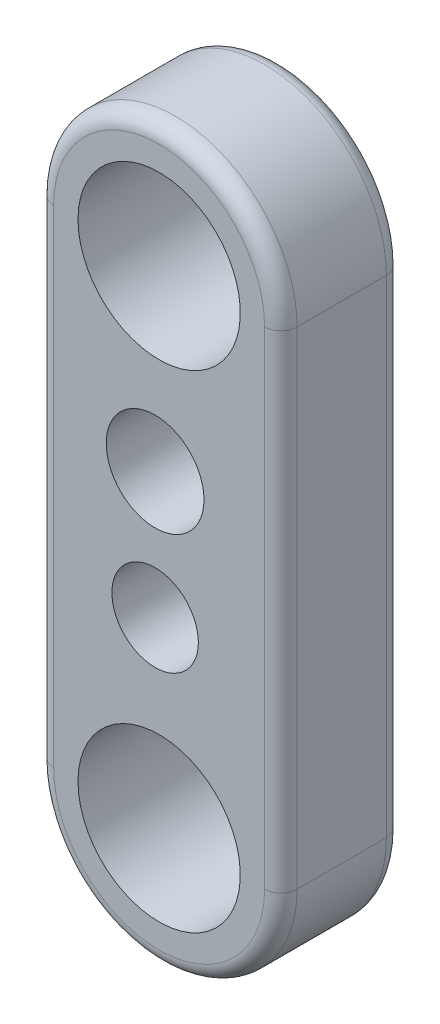
from build123d import *

# Parameters (mm, degrees)
BOSS_EXTRUDE2_DEPTH = 19.05
SKETCH2_R           = 12.7
CUT_EXTRUDE1_DEPTH  = 76.815021516
FILLET1_R           = 2.54
FILLET2_R           = 2.54
SKETCH9_R           = 7.651092206
SKETCH9_R_2         = 6.766631781
CUT_EXTRUDE7_DEPTH  = 76.815021516


with BuildPart() as part:
    # Sketch1 → Boss-Extrude2 (new body)
    with BuildSketch(Plane.XY):
        with BuildLine():
            Line((-29.739928058, 28.163848921), (-29.739928058, -48.036151079))
            ThreePointArc((-29.739928058, -48.036151079), (-10.689928058, -67.086151079), (8.360071942, -48.036151079))
            Line((8.360071942, -48.036151079), (8.360071942, 28.163848921))
            ThreePointArc((8.360071942, 28.163848921), (-10.689928058, 47.213848921), (-29.739928058, 28.163848921))
        make_face()
    extrude(amount=BOSS_EXTRUDE2_DEPTH)

    # Sketch2 → Cut-Extrude1 (cut, through all)
    with BuildSketch(Plane(origin=(0, 0, 0), x_dir=(-1, 0, 0), z_dir=(0, 0, -1))):
        with Locations((10.689928058, 28.163848921)):
            Circle(SKETCH2_R)
        with Locations((10.689928058, -48.036151079)):
            Circle(SKETCH2_R)
    extrude(amount=-CUT_EXTRUDE1_DEPTH, mode=Mode.SUBTRACT)

    # Fillet1
    fillet1_edges = [part.edges().sort_by_distance(p)[0] for p in [
        (8.360071942, -9.936151079, 19.05),
        (-10.689928058, 47.213848921, 19.05),
        (-29.739928058, -9.936151079, 19.05),
        (-10.689928058, -67.086151079, 19.05),
    ]]
    fillet(fillet1_edges, radius=FILLET1_R)

    # Fillet2
    fillet2_edges = [part.edges().sort_by_distance(p)[0] for p in [
        (-10.689928058, 47.213848921, 0),
        (8.360071942, -9.936151079, 0),
        (-10.689928058, -67.086151079, 0),
        (-29.739928058, -9.936151079, 0),
    ]]
    fillet(fillet2_edges, radius=FILLET2_R)

    # Sketch9 → Cut-Extrude7 (cut, through all)
    with BuildSketch(Plane.XY.offset(19.05)):
        with Locations((-11.320081568, 0)):
            Circle(SKETCH9_R)
        with Locations((-11.320081568, -19.793552428)):
            Circle(SKETCH9_R_2)
    extrude(amount=-CUT_EXTRUDE7_DEPTH, mode=Mode.SUBTRACT)


solid = part.part
